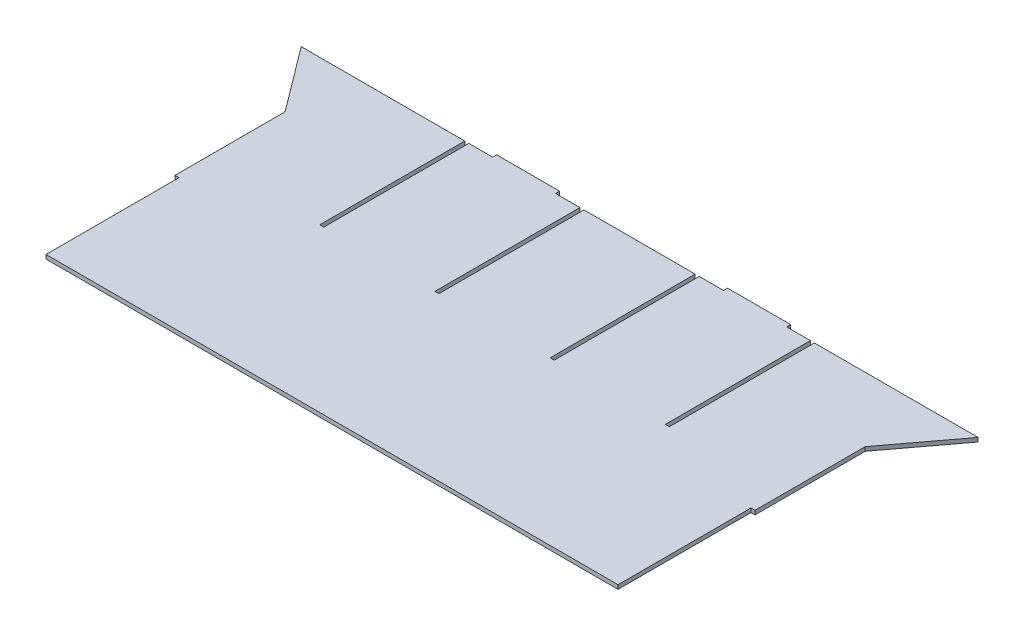
from build123d import *

# Parameters (mm, degrees)
SKETCH1_W           = 457.2020066
SKETCH1_H           = 3.175
BOSS_EXTRUDE1_DEPTH = 242.425000036
SKETCH2_W           = 3.175
SKETCH2_H           = 114.3
CUT_EXTRUDE1_DEPTH  = 334.224218774
LPATTERN1_COUNT     = 4
LPATTERN1_PITCH     = 90.807
SKETCH3_W           = 49.658811606
SKETCH3_H           = 3.175
BOSS_EXTRUDE2_DEPTH = 3.175
BOSS_EXTRUDE3_DEPTH = 3.175
SKETCH5_W           = 3.175
SKETCH5_H           = 104.775
CUT_EXTRUDE2_DEPTH  = 3.175


with BuildPart() as part:
    # Sketch1 → Boss-Extrude1 (new body)
    with BuildSketch(Plane.XY):
        Rectangle(SKETCH1_W, SKETCH1_H)
    extrude(amount=BOSS_EXTRUDE1_DEPTH)

    # Sketch2 → Cut-Extrude1 (cut, through all)
    with BuildSketch(Plane(origin=(0, 1.5875, 0), x_dir=(1, 0, 0), z_dir=(0, 1, 0))):
        with Locations((136.2085033, -57.15)):
            Rectangle(SKETCH2_W, SKETCH2_H)
    cut_extrude1 = extrude(amount=-CUT_EXTRUDE1_DEPTH, mode=Mode.SUBTRACT)

    # LPattern1: Cut-Extrude1 ×4
    with Locations(*[(-i * LPATTERN1_PITCH, 0, 0) for i in range(1, LPATTERN1_COUNT)]):
        add(cut_extrude1, mode=Mode.SUBTRACT)

    # Sketch3 → Boss-Extrude2 (add)
    with BuildSketch(Plane(origin=(0, 0, 0), x_dir=(-1, 0, 0), z_dir=(0, 0, -1))):
        with Locations((-91.009597469, 0)):
            Rectangle(SKETCH3_W, SKETCH3_H)
        with Locations((91.030590869, 0)):
            Rectangle(SKETCH3_W, SKETCH3_H)
    extrude(amount=BOSS_EXTRUDE2_DEPTH)

    # Sketch4 → Boss-Extrude3 (add)
    with BuildSketch(Plane.XZ.offset(1.5875)):
        Polygon((-228.6010033, 0), (-266.7010033, 0), (-228.6010033, 50.8), align=None)
    boss_extrude3 = extrude(amount=-BOSS_EXTRUDE3_DEPTH)

    # Mirror1: Boss-Extrude3 across plane
    add(boss_extrude3.mirror(Plane(origin=(0, 0, 0), x_dir=(0, 0, 1), z_dir=(1, 0, 0))))

    # Sketch5 → Cut-Extrude2 (cut)
    with BuildSketch(Plane.XZ.offset(1.5875)):
        with Locations((-227.0135033, 190.037500036)):
            Rectangle(SKETCH5_W, SKETCH5_H)
    cut_extrude2 = extrude(amount=-CUT_EXTRUDE2_DEPTH, mode=Mode.SUBTRACT)

    # Mirror2: Cut-Extrude2 across plane
    add(cut_extrude2.mirror(Plane(origin=(0, 0, 0), x_dir=(0, 0, 1), z_dir=(1, 0, 0))), mode=Mode.SUBTRACT)


solid = part.part
